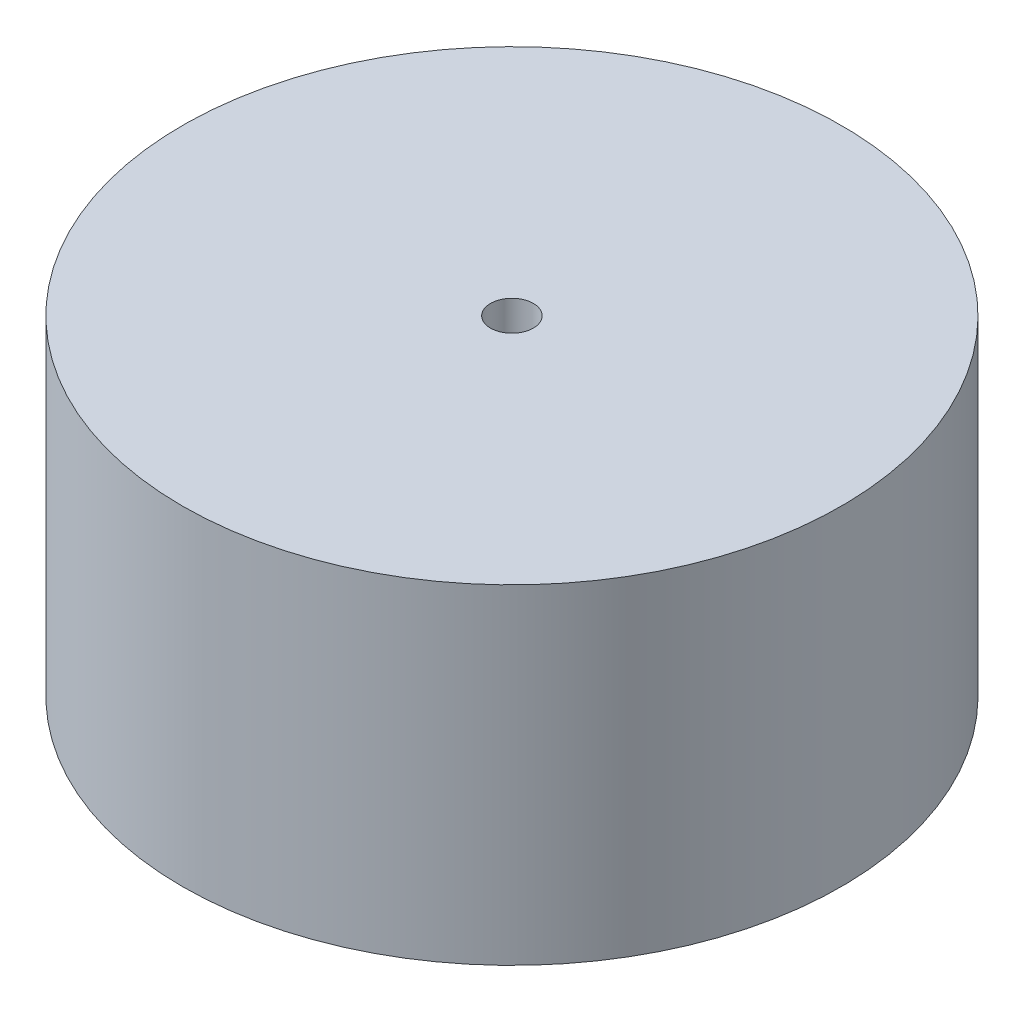
from build123d import *

# Parameters (mm, degrees)
SKETCH1_R           = 10
BOSS_EXTRUDE1_DEPTH = 10
SKETCH2_R           = 0.65
CUT_EXTRUDE1_DEPTH  = 10


with BuildPart() as part:
    # Sketch1 → Boss-Extrude1 (new body)
    with BuildSketch(Plane(origin=(0, 0, 0), x_dir=(1, 0, 0), z_dir=(0, 1, 0))):
        with Locations(Location((0, 0, 0), (0, 0, 270))):
            Circle(SKETCH1_R)
    extrude(amount=BOSS_EXTRUDE1_DEPTH)

    # Sketch2 → Cut-Extrude1 (cut)
    with BuildSketch(Plane(origin=(0, 10, 0), x_dir=(1, 0, 0), z_dir=(0, 1, 0))):
        with Locations(Location((0, 0, 0), (0, 0, 270))):
            Circle(SKETCH2_R)
    extrude(amount=-CUT_EXTRUDE1_DEPTH, mode=Mode.SUBTRACT)


solid = part.part
